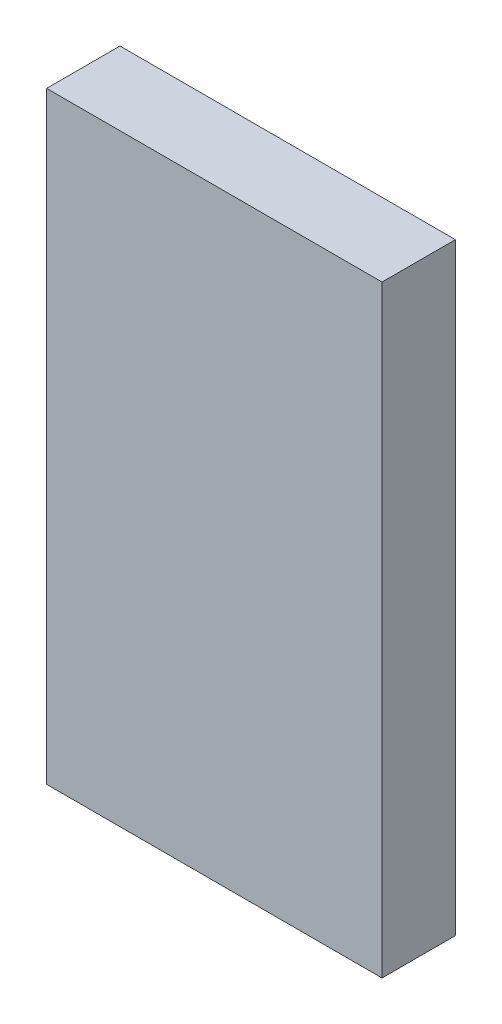
from build123d import *

# Parameters (mm, degrees)
SKETCH1_W           = 12.8
SKETCH1_H           = 23
BOSS_EXTRUDE1_DEPTH = 2.8


with BuildPart() as part:
    # Sketch1 → Boss-Extrude1 (new body)
    with BuildSketch(Plane.XY):
        with Locations((6.4, 11.5)):
            Rectangle(SKETCH1_W, SKETCH1_H)
    extrude(amount=BOSS_EXTRUDE1_DEPTH)


solid = part.part
